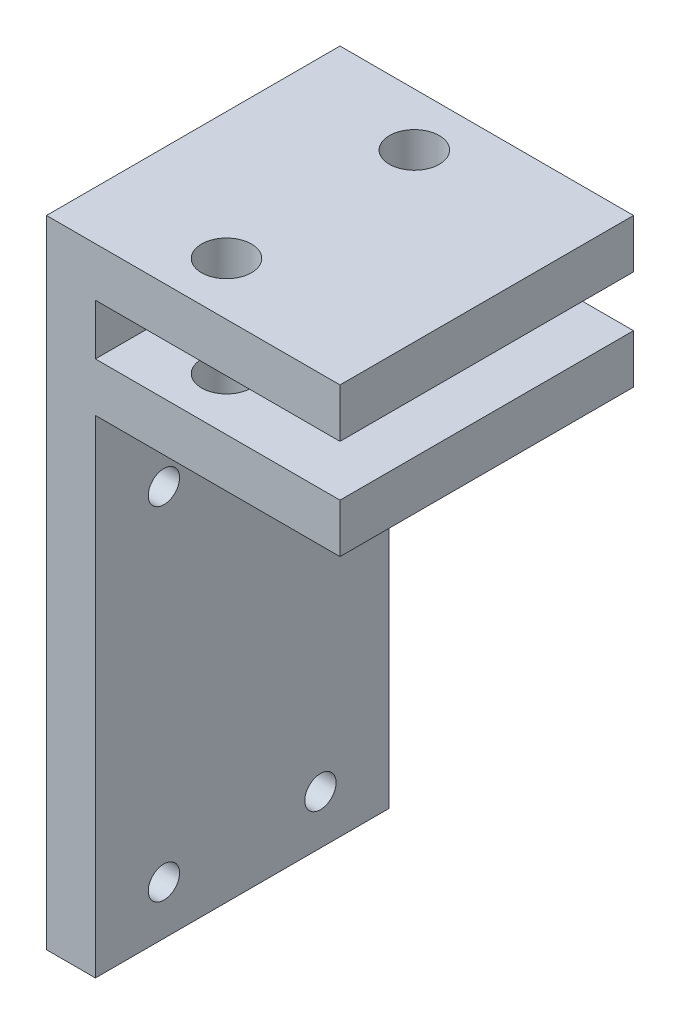
from build123d import *

# Parameters (mm, degrees)
BOSS_EXTRUDE1_DEPTH = 30
CUT_EXTRUDE1_REACH  = 75.485
SKETCH2_R           = 1.6
SKETCH3_R           = 2.55
CUT_EXTRUDE2_DEPTH  = 78.620873481


with BuildPart() as part:
    # Sketch1 → Boss-Extrude1 (new body)
    with BuildSketch(Plane.XY):
        Polygon((0, 0), (0, 5), (-30, 5), (-30, -60), (-25, -60), (-25, -10.2), (0, -10.2), (0, -5.2), (-25, -5.2), (-25, 0), align=None)
    extrude(amount=BOSS_EXTRUDE1_DEPTH)

    # Sketch2 → Cut-Extrude1 (cut, up to next)
    with BuildSketch(Plane.ZY.offset(30), mode=Mode.PRIVATE) as cut_extrude1_sk1:
        with Locations(Location((7, -20, 0), (0, 0, 270))):
            Circle(SKETCH2_R)
    cut_extrude1_tool1 = extrude(cut_extrude1_sk1.sketch, amount=-CUT_EXTRUDE1_REACH, mode=Mode.PRIVATE) & part.part
    # Sketch2 → Cut-Extrude1 (cut, up to next)
    with BuildSketch(Plane.ZY.offset(30), mode=Mode.PRIVATE) as cut_extrude1_sk2:
        with Locations(Location((23, -20, 0), (0, 0, 270))):
            Circle(SKETCH2_R)
    cut_extrude1_tool2 = extrude(cut_extrude1_sk2.sketch, amount=-CUT_EXTRUDE1_REACH, mode=Mode.PRIVATE) & part.part
    # Sketch2 → Cut-Extrude1 (cut, up to next)
    with BuildSketch(Plane.ZY.offset(30), mode=Mode.PRIVATE) as cut_extrude1_sk3:
        with Locations(Location((7, -55, 0), (0, 0, 270))):
            Circle(SKETCH2_R)
    cut_extrude1_tool3 = extrude(cut_extrude1_sk3.sketch, amount=-CUT_EXTRUDE1_REACH, mode=Mode.PRIVATE) & part.part
    # Sketch2 → Cut-Extrude1 (cut, up to next)
    with BuildSketch(Plane.ZY.offset(30), mode=Mode.PRIVATE) as cut_extrude1_sk4:
        with Locations(Location((23, -55, 0), (0, 0, 270))):
            Circle(SKETCH2_R)
    cut_extrude1_tool4 = extrude(cut_extrude1_sk4.sketch, amount=-CUT_EXTRUDE1_REACH, mode=Mode.PRIVATE) & part.part
    add(cut_extrude1_tool1.solids().sort_by_distance((-30, -20, 7))[0], mode=Mode.SUBTRACT)
    add(cut_extrude1_tool2.solids().sort_by_distance((-30, -20, 23))[0], mode=Mode.SUBTRACT)
    add(cut_extrude1_tool3.solids().sort_by_distance((-30, -55, 7))[0], mode=Mode.SUBTRACT)
    add(cut_extrude1_tool4.solids().sort_by_distance((-30, -55, 23))[0], mode=Mode.SUBTRACT)

    # Sketch3 → Cut-Extrude2 (cut, through all)
    with BuildSketch(Plane(origin=(0, 5, 0), x_dir=(1, 0, 0), z_dir=(0, 1, 0))):
        with Locations(Location((-17, -5.4, 0), (0, 0, 180))):
            Circle(SKETCH3_R)
        with Locations(Location((-17, -24.6, 0), (0, 0, 180))):
            Circle(SKETCH3_R)
    extrude(amount=-CUT_EXTRUDE2_DEPTH, mode=Mode.SUBTRACT)


solid = part.part
